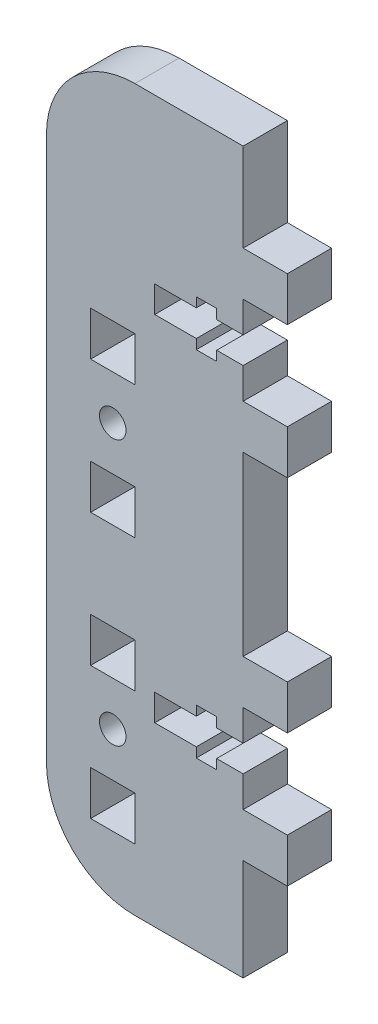
from build123d import *

# Parameters (mm, degrees)
SKETCH1_R           = 1.5
SKETCH1_W           = 5
SKETCH1_H           = 5
BOSS_EXTRUDE1_DEPTH = 5
CONG_1_R            = 10


with BuildPart() as part:
    # Sketch1 → Boss-Extrude1 (new body)
    with BuildSketch(Plane.XY):
        Polygon((22.25, 81.5), (22.25, 71.5), (27.25, 71.5), (27.25, 66.5), (22.25, 66.5), (22.25, 63), (19.25, 63), (19.25, 64.1), (16.95, 64.1), (16.95, 63), (12.25, 63), (12.25, 60), (16.95, 60), (16.95, 58.9), (19.25, 58.9), (19.25, 60), (22.25, 60), (22.25, 56.5), (27.25, 56.5), (27.25, 51.5), (22.25, 51.5), (22.25, 31.5), (27.25, 31.5), (27.25, 26.5), (22.25, 26.5), (22.25, 23), (19.25, 23), (19.25, 24.1), (16.95, 24.1), (16.95, 23), (12.25, 23), (12.25, 20), (16.95, 20), (16.95, 18.9), (19.25, 18.9), (19.25, 20), (22.25, 20), (22.25, 16.5), (27.25, 16.5), (27.25, 11.5), (22.25, 11.5), (22.25, 0), (0, 0), (0, 81.5), align=None)
        with Locations((7.5, 47)):
            Circle(SKETCH1_R, mode=Mode.SUBTRACT)
        with Locations((7.5, 17)):
            Circle(SKETCH1_R, mode=Mode.SUBTRACT)
        with Locations((7.5, 39.5)):
            Rectangle(SKETCH1_W, SKETCH1_H, mode=Mode.SUBTRACT)
        with Locations((7.5, 54.5)):
            Rectangle(SKETCH1_W, SKETCH1_H, mode=Mode.SUBTRACT)
        with Locations((7.5, 9.5)):
            Rectangle(SKETCH1_W, SKETCH1_H, mode=Mode.SUBTRACT)
        with Locations((7.5, 24.5)):
            Rectangle(SKETCH1_W, SKETCH1_H, mode=Mode.SUBTRACT)
    extrude(amount=BOSS_EXTRUDE1_DEPTH)

    # Congé1
    cong_1_edges = [part.edges().sort_by_distance(p)[0] for p in [
        (0, 0, 2.5),
        (0, 81.5, 2.5),
    ]]
    fillet(cong_1_edges, radius=CONG_1_R)


solid = part.part
